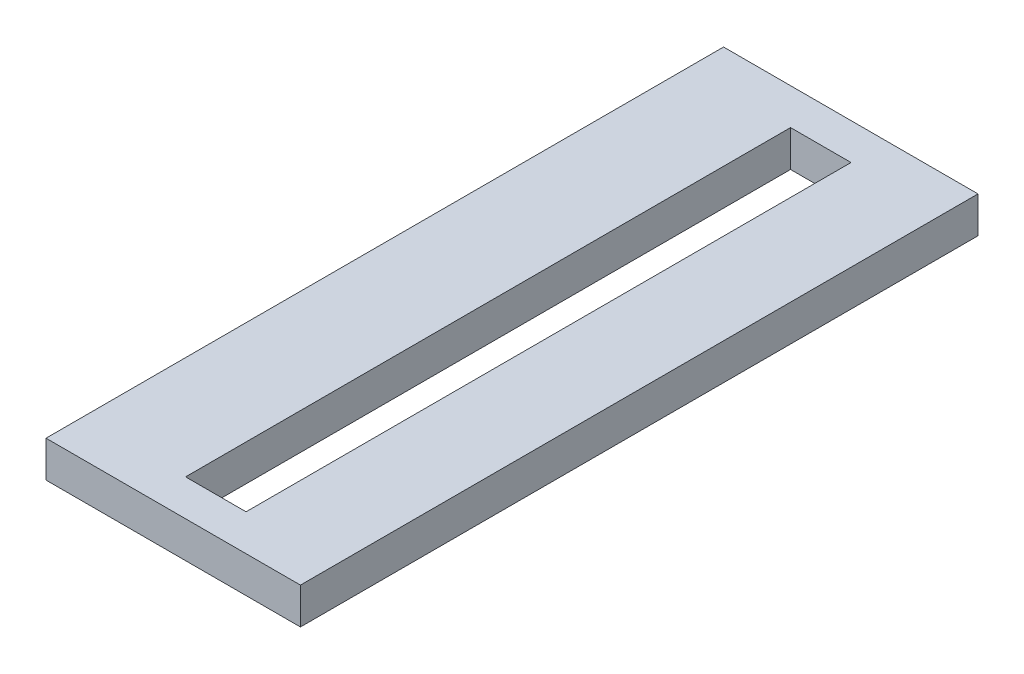
from build123d import *

# Parameters (mm, degrees)
ESQUISSE1_W   = 21.029076311
ESQUISSE1_H   = 56
ESQUISSE1_W_2 = 5
ESQUISSE1_H_2 = 50
BASE_DEPTH    = 3


with BuildPart() as part:
    # Esquisse1 → BASE (new body)
    with BuildSketch(Plane(origin=(0, 0, 0), x_dir=(1, 0, 0), z_dir=(0, 1, 0))):
        with Locations((33.792254344, 0)):
            Rectangle(ESQUISSE1_W, ESQUISSE1_H)
        with Locations((34.31333568, 0)):
            Rectangle(ESQUISSE1_W_2, ESQUISSE1_H_2, mode=Mode.SUBTRACT)
    extrude(amount=BASE_DEPTH)


solid = part.part
